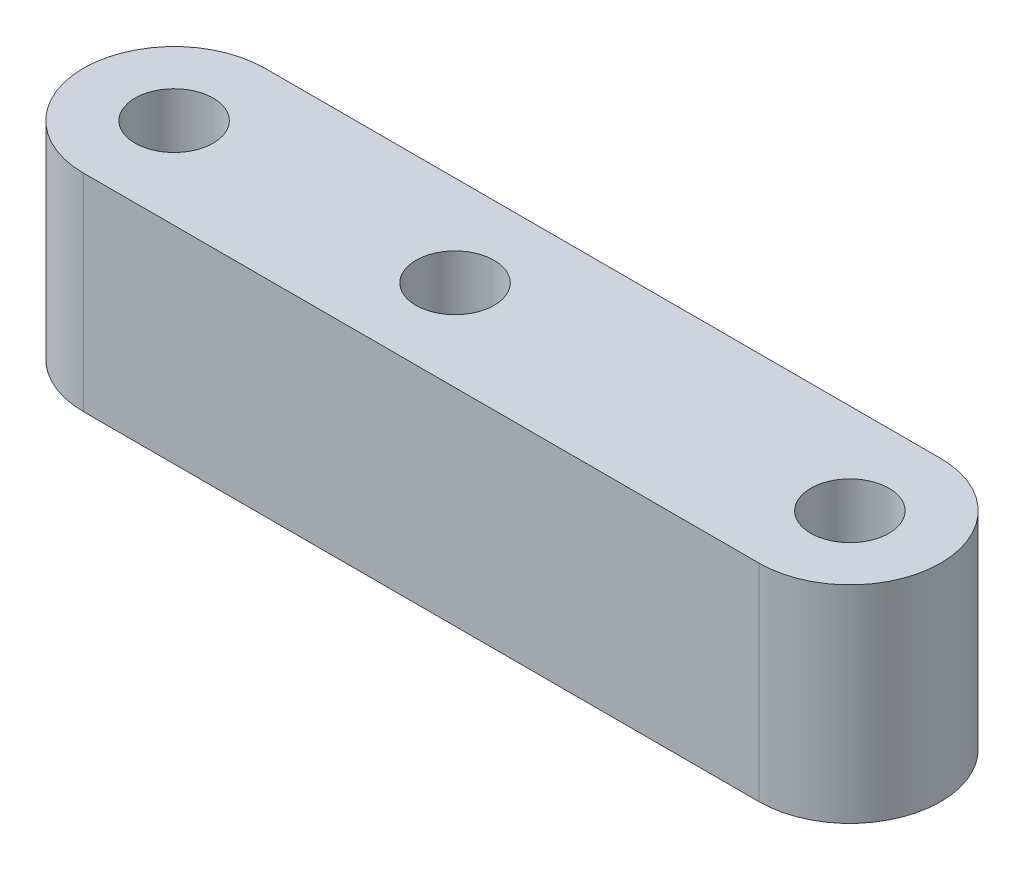
from build123d import *

# Parameters (mm, degrees)
SKETCH1_R           = 3.556
BOSS_EXTRUDE1_DEPTH = 9.398


with BuildPart() as part:
    # Sketch1 → Boss-Extrude1 (new, symmetric)
    with BuildSketch(Plane(origin=(0, 0, 0), x_dir=(1, 0, 0), z_dir=(0, 1, 0))):
        with BuildLine():
            Line((0, 8.255), (61.468, 8.255))
            ThreePointArc((61.468, 8.255), (69.723, 0), (61.468, -8.255))
            Line((61.468, -8.255), (0, -8.255))
            ThreePointArc((0, -8.255), (-8.255, 0), (0, 8.255))
        make_face()
        with Locations(Location((0, 0, 0), (0, 0, 270))):
            Circle(SKETCH1_R, mode=Mode.SUBTRACT)
        with Locations(Location((25.5524, 0, 0), (0, 0, 270))):
            Circle(SKETCH1_R, mode=Mode.SUBTRACT)
        with Locations(Location((61.468, 0, 0), (0, 0, 270))):
            Circle(SKETCH1_R, mode=Mode.SUBTRACT)
    extrude(amount=BOSS_EXTRUDE1_DEPTH, both=True)


solid = part.part
